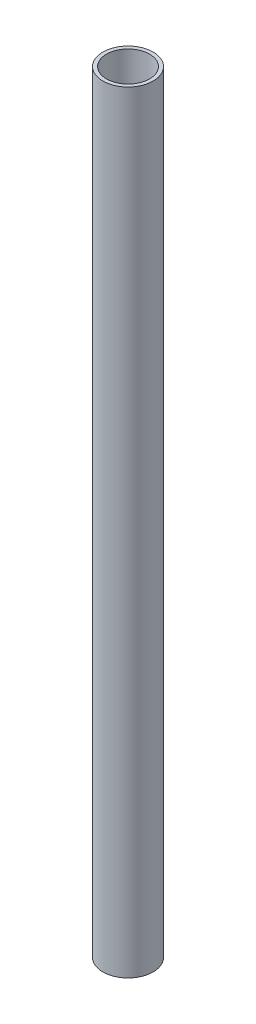
from build123d import *

# Parameters (mm, degrees)
TUBE_ROND_R            = 7
TUBE_ROND_R_2          = 6
TUBE_ROND_14X1_1_DEPTH = 215


with BuildPart() as part:
    # tube rond → Tube rond 14X1(1) (new body)
    with BuildSketch(Plane.XZ.offset(-107.5)):
        Circle(TUBE_ROND_R)
        Circle(TUBE_ROND_R_2, mode=Mode.SUBTRACT)
    extrude(amount=TUBE_ROND_14X1_1_DEPTH)


solid = part.part
